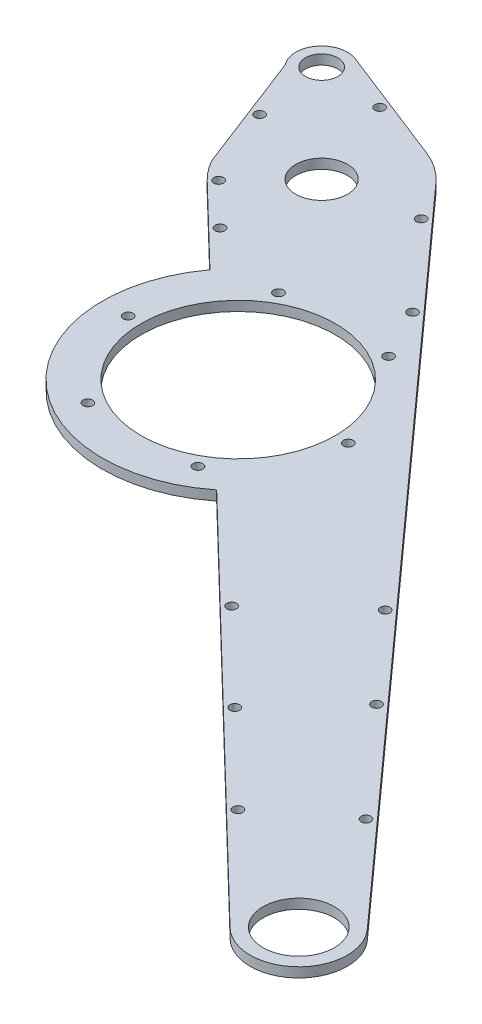
from build123d import *

# Parameters (mm, degrees)
SKETCH1_R           = 30
SKETCH1_R_2         = 5
SKETCH1_R_3         = 8
SKETCH1_R_4         = 1.5
SKETCH1_R_5         = 11
BOSS_EXTRUDE1_DEPTH = 3
CUT_EXTRUDE1_START  = -10
SKETCH2_R           = 8
SKETCH2_R_2         = 1.5
CUT_EXTRUDE1_DEPTH  = 10


with BuildPart() as part:
    # Sketch1 → Boss-Extrude1 (new body)
    with BuildSketch(Plane(origin=(0, 0, 0), x_dir=(1, 0, 0), z_dir=(0, 1, 0))):
        with BuildLine():
            Line((9.113159771, 23.279826438), (-27.083788873, 37.44954446))
            ThreePointArc((-27.083788873, 37.44954446), (-36.443445881, 34.74151929), (-36.244997998, 25))
            Line((-36.244997998, 25), (-22, -11.874342087))
            ThreePointArc((-22, -11.874342087), (-19.917132472, -15.109858837), (-17.362407178, -17.987407178))
            Line((-17.362407178, -17.987407178), (6.954011254, -41.458914425))
            ThreePointArc((6.954011254, -41.458914425), (11.530098852, -96.683349609), (66.881782611, -99.30440362))
            Line((66.881782611, -99.30440362), (186.110074258, -214.389925742))
            ThreePointArc((186.110074258, -214.389925742), (206.945082055, -214.389810698), (207.681250796, -193.567812582))
            Line((207.681250796, -193.567812582), (18.589553719, 16.716114756))
            ThreePointArc((18.589553719, 16.716114756), (14.234839706, 20.551626178), (9.113159771, 23.279826438))
        make_face()
        with Locations(Location((40.698942911, -66.46450555, 0), (0, 0, 270))):
            Circle(SKETCH1_R, mode=Mode.SUBTRACT)
        with Locations(Location((-30, 30, 0), (0, 0, 270))):
            Circle(SKETCH1_R_2, mode=Mode.SUBTRACT)
        with Locations(Location((0, 0, 0), (0, 0, 270))):
            Circle(SKETCH1_R_3, mode=Mode.SUBTRACT)
        with Locations(Location((57.698942911, -37.019641821, 0), (0, 0, 270))):
            Circle(SKETCH1_R_4, mode=Mode.SUBTRACT)
        with Locations(Location((23.698942911, -37.019641821, 0), (0, 0, 270))):
            Circle(SKETCH1_R_4, mode=Mode.SUBTRACT)
        with Locations(Location((74.698942911, -66.46450555, 0), (0, 0, 270))):
            Circle(SKETCH1_R_4, mode=Mode.SUBTRACT)
        with Locations(Location((6.698942911, -66.46450555, 0), (0, 0, 270))):
            Circle(SKETCH1_R_4, mode=Mode.SUBTRACT)
        with Locations(Location((57.698942911, -95.909369279, 0), (0, 0, 270))):
            Circle(SKETCH1_R_4, mode=Mode.SUBTRACT)
        with Locations(Location((23.698942911, -95.909369279, 0), (0, 0, 270))):
            Circle(SKETCH1_R_4, mode=Mode.SUBTRACT)
        with Locations(Location((196.527518564, -203.597481436, 0), (0, 0, 270))):
            Circle(SKETCH1_R_5, mode=Mode.SUBTRACT)
    extrude(amount=BOSS_EXTRUDE1_DEPTH)

    # Sketch2 → Cut-Extrude1 (cut)
    with BuildSketch(Plane(origin=(0, 3, 0), x_dir=(1, 0, 0), z_dir=(0, 1, 0)).offset(CUT_EXTRUDE1_START)):
        with Locations(Location((0, 0, 0), (0, 0, 270))):
            Circle(SKETCH2_R)
        with Locations(Location((-15.62616646, -16.18866646, 0), (0, 0, 270))):
            Circle(SKETCH2_R_2)
        with Locations(Location((-2.656534873, -28.707648342, 0), (0, 0, 270))):
            Circle(SKETCH2_R_2)
        with Locations(Location((127.883379131, -154.711753185, 0), (0, 0, 270))):
            Circle(SKETCH2_R_2)
        with Locations(Location((100.268681967, -128.056570951, 0), (0, 0, 270))):
            Circle(SKETCH2_R_2)
        with Locations(Location((155.700523111, -181.562347912, 0), (0, 0, 270))):
            Circle(SKETCH2_R_2)
        with Locations(Location((148.934969969, -131.976518297, 0), (0, 0, 270))):
            Circle(SKETCH2_R_2)
        with Locations(Location((177.993903369, -164.292197589, 0), (0, 0, 270))):
            Circle(SKETCH2_R_2)
        with Locations(Location((125.057017775, -105.422472605, 0), (0, 0, 270))):
            Circle(SKETCH2_R_2)
        with Locations(Location((49.600984197, -21.509792527, 0), (0, 0, 270))):
            Circle(SKETCH2_R_2)
        with Locations(Location((25.948559408, 4.79345004, 0), (0, 0, 270))):
            Circle(SKETCH2_R_2)
        with Locations(Location((-26.895954044, 7.736794096, 0), (0, 0, 270))):
            Circle(SKETCH2_R_2)
        with Locations(Location((-10.272154034, 28.183705865, 0), (0, 0, 270))):
            Circle(SKETCH2_R_2)
    extrude(amount=CUT_EXTRUDE1_DEPTH, mode=Mode.SUBTRACT)


solid = part.part
